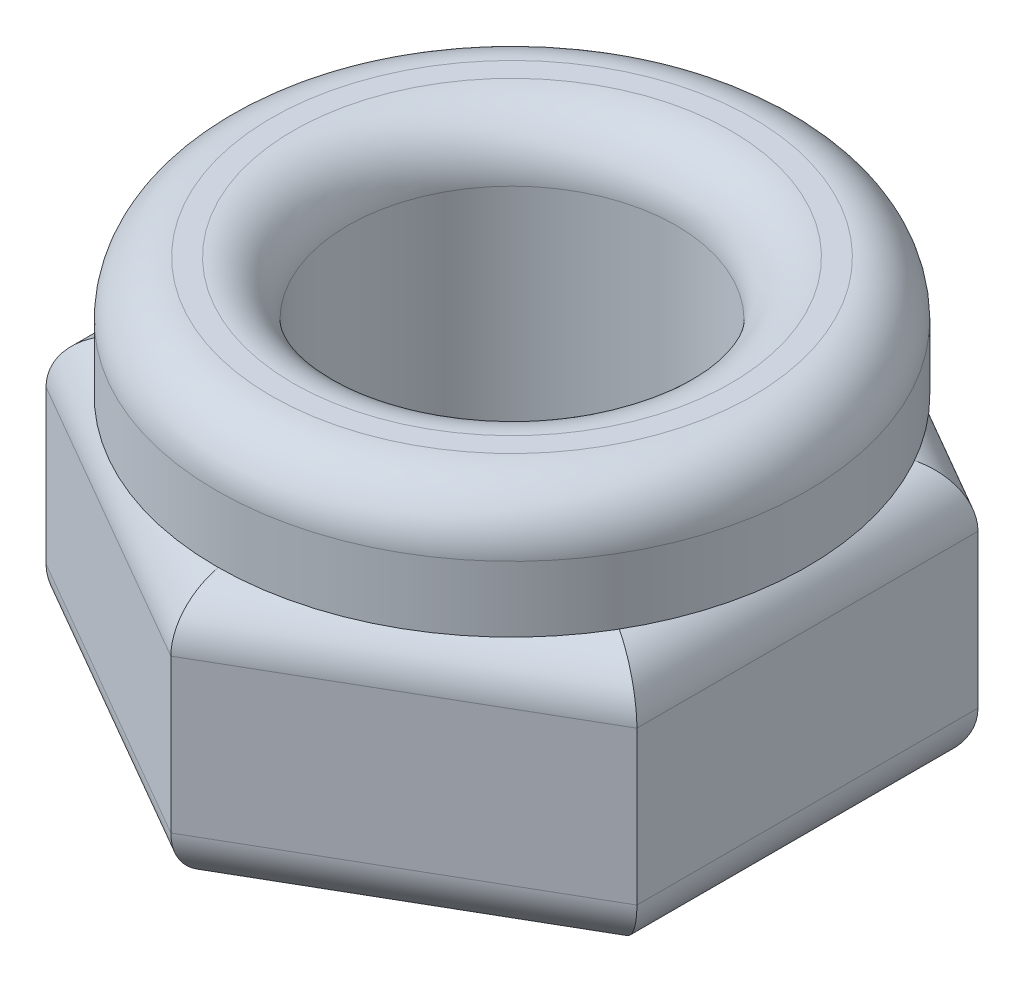
from build123d import *

# Parameters (mm, degrees)
EXTRUDE_1_DEPTH     = 2.4
SKETCH_2_R          = 1.5
CUT_EXTRUDE_1_DEPTH = 10
FILLET_1_R          = 0.5
EXTRUDE_START       = 1.1
SKETCH_3_R          = 2.7
SKETCH_3_R_2        = 1.5
EXTRUDE_2_DEPTH     = 1.1
FILLET_2_R          = 0.5


with BuildPart() as part:
    # 草图1 → 凸台-拉伸1 (new body)
    with BuildSketch(Plane(origin=(0, 0, 0), x_dir=(1, 0, 0), z_dir=(0, 1, 0))):
        Polygon((0, 3.117691454), (-2.7, 1.558845727), (-2.7, -1.558845727), (0, -3.117691454), (2.7, -1.558845727), (2.7, 1.558845727), align=None)
    extrude(amount=EXTRUDE_1_DEPTH)

    # 草图2 → 切除-拉伸1 (cut)
    with BuildSketch(Plane(origin=(0, 2.4, 0), x_dir=(1, 0, 0), z_dir=(0, 1, 0))):
        with Locations(Location((0, 0, 0), (0, 0, 270))):
            Circle(SKETCH_2_R)
    extrude(amount=-CUT_EXTRUDE_1_DEPTH, mode=Mode.SUBTRACT)

    # 圆角1
    fillet_1_edges = [part.edges().sort_by_distance(p)[0] for p in [
        (-2.7, 2.4, 0),
        (-1.35, 2.4, 2.33826859),
        (1.35, 2.4, 2.33826859),
        (2.7, 2.4, 0),
        (1.35, 2.4, -2.33826859),
        (2.7, 0, 0),
        (1.35, 0, 2.33826859),
        (-1.35, 0, 2.33826859),
        (-2.7, 0, 0),
        (-1.35, 0, -2.33826859),
        (1.35, 0, -2.33826859),
        (-1.35, 2.4, -2.33826859),
    ]]
    fillet(fillet_1_edges, radius=FILLET_1_R)

    # 草图3 → 凸台-拉伸2 (add)
    with BuildSketch(Plane(origin=(0, 2.4, 0), x_dir=(1, 0, 0), z_dir=(0, 1, 0)).offset(EXTRUDE_START)):
        with Locations(Location((0, 0, 0), (0, 0, 270))):
            Circle(SKETCH_3_R)
        with Locations(Location((0, 0, 0), (0, 0, 270))):
            Circle(SKETCH_3_R_2, mode=Mode.SUBTRACT)
    extrude(amount=-EXTRUDE_2_DEPTH)

    # 圆角2
    fillet_2_edges = [part.edges().sort_by_distance(p)[0] for p in [
        (0, 3.5, -2.7),
        (0, 3.5, -1.5),
    ]]
    fillet(fillet_2_edges, radius=FILLET_2_R)


solid = part.part
